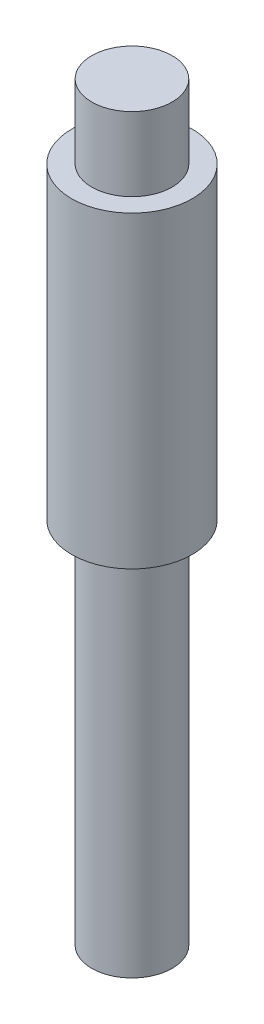
from build123d import *

# Parameters (mm, degrees)
SKETCH1_R           = 1.5
BOSS_EXTRUDE1_DEPTH = 13.75
SKETCH2_R           = 2.25
BOSS_EXTRUDE2_DEPTH = 11.5
BOSS_EXTRUDE3_START = 2.75
SKETCH3_R           = 1.5
BOSS_EXTRUDE3_DEPTH = 2.75


with BuildPart() as part:
    # Sketch1 → Boss-Extrude1 (new body)
    with BuildSketch(Plane(origin=(0, 0, 0), x_dir=(1, 0, 0), z_dir=(0, 1, 0))):
        with Locations(Location((0, 0, 0), (0, 0, 270))):
            Circle(SKETCH1_R)
    extrude(amount=-BOSS_EXTRUDE1_DEPTH)

    # Sketch2 → Boss-Extrude2 (add)
    with BuildSketch(Plane(origin=(0, 0, 0), x_dir=(1, 0, 0), z_dir=(0, 1, 0))):
        with Locations(Location((0, 0, 0), (0, 0, 270))):
            Circle(SKETCH2_R)
    extrude(amount=BOSS_EXTRUDE2_DEPTH)

    # Sketch3 → Boss-Extrude3 (add)
    with BuildSketch(Plane(origin=(0, 11.5, 0), x_dir=(1, 0, 0), z_dir=(0, 1, 0)).offset(BOSS_EXTRUDE3_START)):
        with Locations(Location((0, 0, 0), (0, 0, 270))):
            Circle(SKETCH3_R)
    extrude(amount=-BOSS_EXTRUDE3_DEPTH)


solid = part.part
